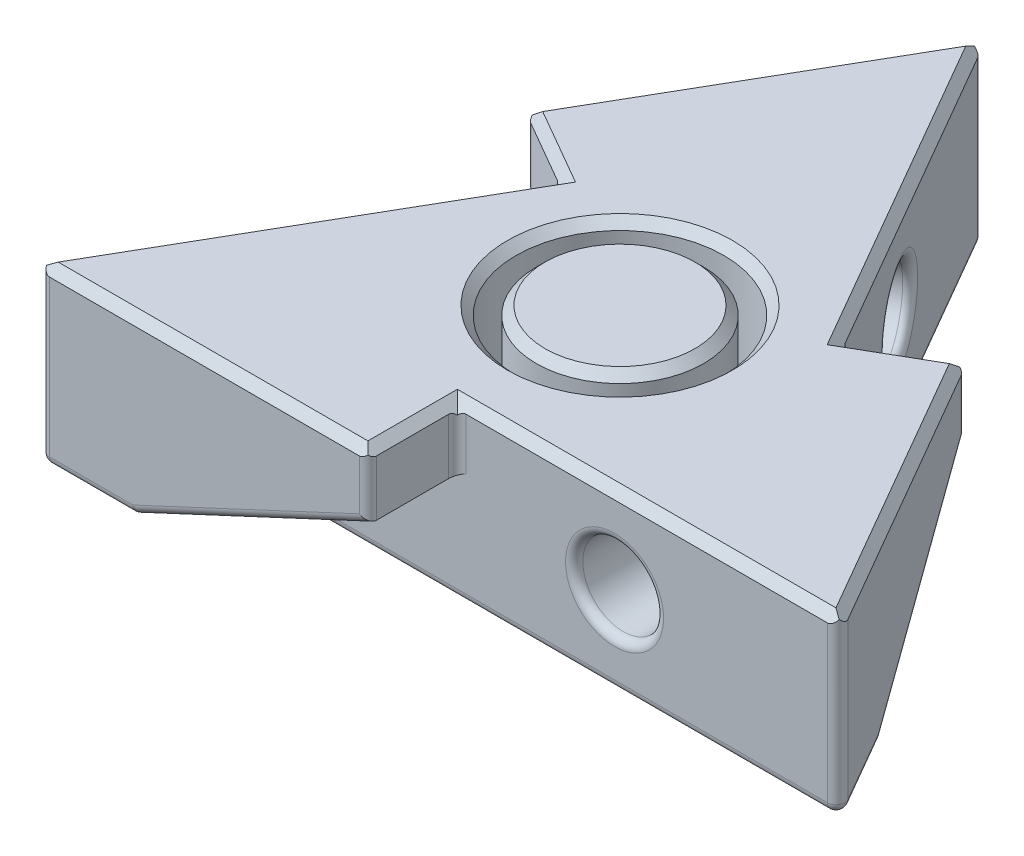
from build123d import *

# Parameters (mm, degrees)
SKETCH1_R           = 7.2
BOSS_EXTRUDE1_DEPTH = 12
SKETCH2_R           = 7.2
BOSS_EXTRUDE2_DEPTH = 2
SKETCH3_R           = 2.7999999999999985
CUT_EXTRUDE1_DEPTH  = 9.1
CUT_EXTRUDE3_DEPTH  = 50.58533021602103
SKETCH8_R           = 5.8
BOSS_EXTRUDE3_DEPTH = 10
CIRPATTERN2_COUNT   = 3
CHAMFER2_SIZE       = 0.6
FILLET3_R           = 0.6


with BuildPart() as part:
    # Sketch1 → Boss-Extrude1 (new body)
    with BuildSketch(Plane(origin=(0, 0, 0), x_dir=(1, 0, 0), z_dir=(0, 1, 0))):
        Polygon((-23.110809387790948, -17.47636535456504), (-9.76561885940777, 5.638182677282097), (-15.134976362871324, 8.738182677282033), (-3.579571668975892, 28.752730709129278), (9.765618859407624, 5.638182677282344), (15.13497636287113, 8.738182677282364), (26.690381056766807, -11.276365354564588), (0, -11.27636535456458), (0, -17.476365354564578), align=None)
        with Locations(Location((0, 0, 0), (0, 0, 270))):
            Circle(SKETCH1_R, mode=Mode.SUBTRACT)
    extrude(amount=BOSS_EXTRUDE1_DEPTH)

    # Sketch2 → Boss-Extrude2 (add)
    with BuildSketch(Plane.XZ):
        with Locations(Location((0, 0, 0), (0, 0, 270))):
            Circle(SKETCH2_R)
    extrude(amount=-BOSS_EXTRUDE2_DEPTH)

    # Sketch3 → Cut-Extrude1 (cut)
    with BuildSketch(Plane.XY.offset(11.27636535456458)):
        with Locations((10.899999999999999, 6)):
            Circle(SKETCH3_R)
    cut_extrude1 = extrude(amount=-CUT_EXTRUDE1_DEPTH, mode=Mode.SUBTRACT)

    # Sketch7 → Cut-Extrude3 (cut, through all)
    with BuildSketch(Plane.XY.offset(11.27636535456458)):
        with BuildLine():
            Line((13.43570957044416, 0.5621532777800846), (-23.41303642284339, -16.620699172297943))
            ThreePointArc((-23.41303642284339, -16.620699172297943), (-31.38659271550747, -13.718562020522187), (-28.484455563731718, -5.7450057278581115))
            Line((-28.484455563731718, -5.7450057278581115), (8.364290429555835, 11.437846722219916))
            ThreePointArc((8.364290429555835, 11.437846722219916), (16.337846722219915, 8.535709570444162), (13.43570957044416, 0.5621532777800846))
        make_face()
    cut_extrude3 = extrude(amount=CUT_EXTRUDE3_DEPTH, mode=Mode.SUBTRACT)

    # Sketch8 → Boss-Extrude3 (add)
    with BuildSketch(Plane(origin=(0, 2, 0), x_dir=(1, 0, 0), z_dir=(0, 1, 0))):
        with Locations(Location((0, 0, 0), (0, 0, 90))):
            Circle(SKETCH8_R)
    extrude(amount=BOSS_EXTRUDE3_DEPTH)

    # CirPattern2: Cut-Extrude1, Cut-Extrude3 ×3 about axis
    cirpattern2_axis = Axis((-8e-16, 0, -3.09e-15), (0, 1, 0))
    add([cut_extrude1.rotate(cirpattern2_axis, i * 360 / CIRPATTERN2_COUNT) for i in range(1, CIRPATTERN2_COUNT)], mode=Mode.SUBTRACT)
    add([cut_extrude3.rotate(cirpattern2_axis, i * 360 / CIRPATTERN2_COUNT) for i in range(1, CIRPATTERN2_COUNT)], mode=Mode.SUBTRACT)

    # Chamfer2
    chamfer2_edges = [part.edges().sort_by_distance(p)[0] for p in [
        (13.345190528383403, 12, 11.276365354564584),
        (20.91267870981897, 12, 1.2690913386411111),
        (12.450297611139376, 12, -7.188182677282353),
        (2.2e-15, 12, -7.2),
        (3.0930235952158665, 12, -17.19545669320581),
        (-9.357274015923608, 12, -18.745456693205654),
        (-12.450297611139547, 12, -7.1881826772820645),
        (-16.43821412359936, 12, 5.919091338641472),
        (-11.555404693895474, 12, 17.47636535456481),
        (-1.07e-15, 12, 5.8),
        (0, 12, 14.37636535456458),
    ]]
    chamfer(chamfer2_edges, length=CHAMFER2_SIZE)

    # Fillet3
    fillet3_edges = [part.edges().sort_by_distance(p)[0] for p in [
        (-5.316211260430414, 0, -25.744782702294316),
        (-11.093913607378132, 3.76875701994284, -15.737508686370697),
        (-4.3681721001530995, 0, -21.186834695459314),
        (7.134086350709061, 0, -10.196130684117296),
        (24.953741465312213, 0, 8.268417347729613),
        (5.263065017397029, 0, 11.276365354564584),
        (-19.63753020488185, 0, 17.47636535456497),
        (-23.110809387790948, 5.700000000000001, 17.47636535456504),
        (-9.76561885940777, 9.468757019942823, -5.638182677282097),
        (-15.134976362871324, 9.468757019942839, -8.738182677282033),
        (-3.579571668975892, 5.700000000000001, -28.752730709129278),
        (9.765618859407624, 9.46875701994278, -5.638182677282344),
        (15.13497636287113, 9.468757019942785, -8.738182677282364),
        (26.690381056766807, 5.7, 11.276365354564588),
        (0, 9.468757019942768, 11.27636535456458),
        (0, 9.468757019942766, 17.476365354564578),
        (8.099999999999996, 6, 11.27636535456458),
        (-8.082125510986373, 3.7687570199427665, 17.476365354564738),
        (-16.164251021972746, 0, 14.376365354564811),
        (-13.815618859407646, 6, 1.3766230933716486),
        (5.715618859407651, 6, -12.652988447936243),
        (19.176039118364372, 3.7687570199427864, -1.7388566681938666),
        (20.532423122125817, 0, 6.810469340894656),
        (-12.397151368106105, 0, -1.0802346704471155),
    ]]
    fillet(fillet3_edges, radius=FILLET3_R)


solid = part.part
